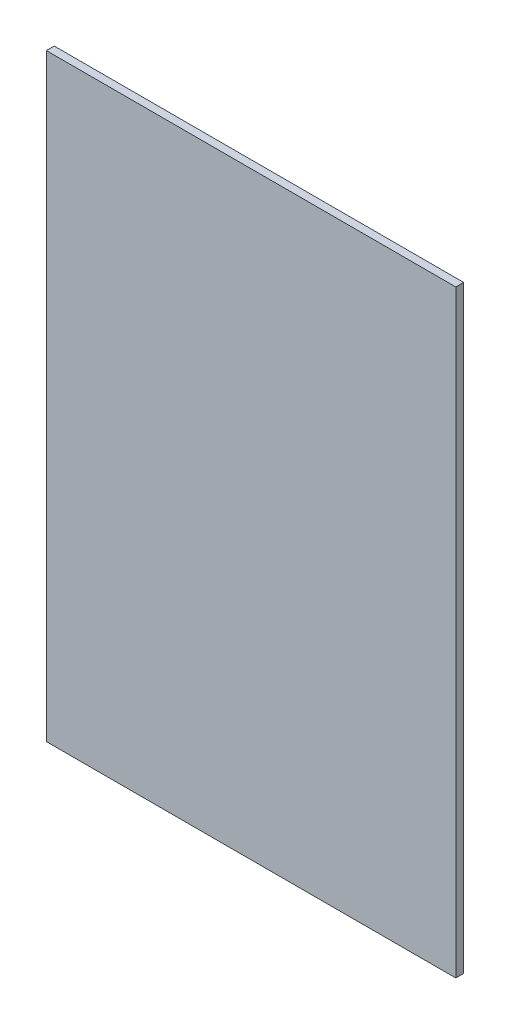
from build123d import *

# Parameters (mm, degrees)
SKETCH1_W           = 260
SKETCH1_H           = 380
BOSS_EXTRUDE1_DEPTH = 2.5


with BuildPart() as part:
    # Sketch1 → Boss-Extrude1 (new, symmetric)
    with BuildSketch(Plane.XY):
        Rectangle(SKETCH1_W, SKETCH1_H)
    extrude(amount=BOSS_EXTRUDE1_DEPTH, both=True)


solid = part.part
